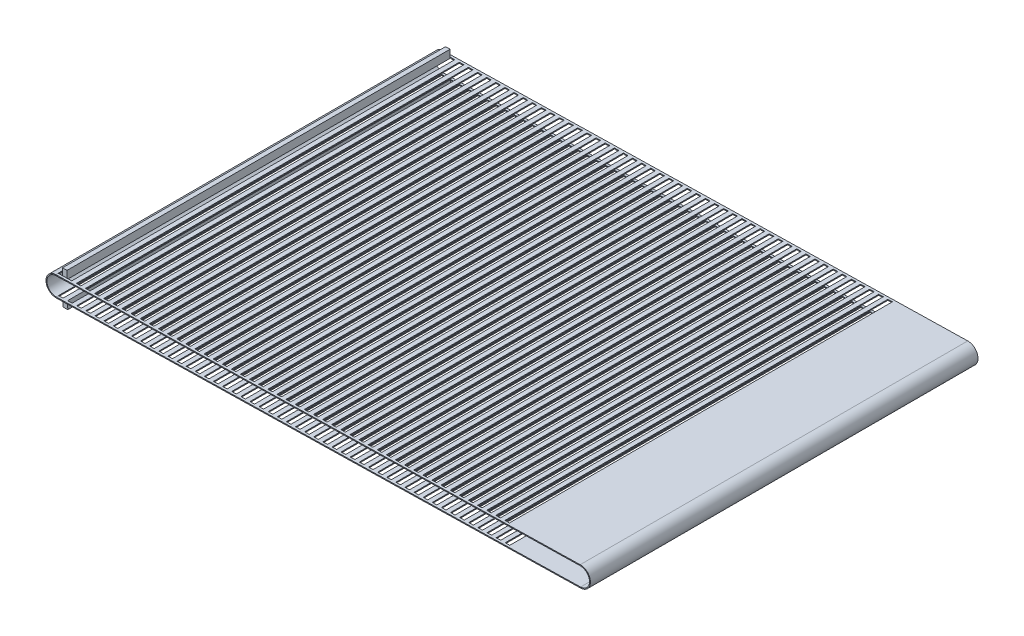
from build123d import *

# Parameters (mm, degrees)
EXTRUDE_THIN1_DEPTH = 850
SKETCH4_W           = 10
SKETCH4_H           = 840
CUT_EXTRUDE1_DEPTH  = 100
SKETCH5_W           = 10
SKETCH5_H           = 840
BOSS_EXTRUDE2_DEPTH = 15
SKETCH6_W           = 10
SKETCH6_H           = 840
BOSS_EXTRUDE3_DEPTH = 15


with BuildPart() as part:
    # Sketch1 → Extrude-Thin1 (new body)
    with BuildSketch(Plane.XY):
        with BuildLine():
            Line((540.307161019, 2.043266258), (-609.692838981, -21.99519528))
            ThreePointArc((-609.692838981, -21.99519528), (-632.147800049, -0.459765788), (-610.612370556, 21.99519528))
            Line((-610.612370556, 21.99519528), (539.387629444, 46.033656819))
            ThreePointArc((539.387629444, 46.033656819), (561.842590512, 24.498227326), (540.307161019, 2.043266258))
        make_face()
        with BuildLine():
            Line((540.265364129, 4.042829465), (-609.734635871, -19.995632073))
            ThreePointArc((-609.734635871, -19.995632073), (-630.148236842, -0.417968898), (-610.570573666, 19.995632073))
            Line((-610.570573666, 19.995632073), (539.429426334, 44.034093612))
            ThreePointArc((539.429426334, 44.034093612), (559.843027304, 24.456430436), (540.265364129, 4.042829465))
        make_face(mode=Mode.SUBTRACT)
    extrude(amount=EXTRUDE_THIN1_DEPTH)

    # Sketch4 → Cut-Extrude1 (cut)
    with BuildSketch(Plane(origin=(-0.726246886, 34.743651043, 0), x_dir=(0.9997816036520575, 0.02089844489239245, 0), z_dir=(-0.020898444892392447, 0.9997816036520574, 0))):
        with Locations((-605.019349668, -425)):
            Rectangle(SKETCH4_W, SKETCH4_H)
        with Locations((-585.019349668, -425)):
            Rectangle(SKETCH4_W, SKETCH4_H)
        with Locations((-565.019349668, -425)):
            Rectangle(SKETCH4_W, SKETCH4_H)
        with Locations((-545.019349668, -425)):
            Rectangle(SKETCH4_W, SKETCH4_H)
        with Locations((-525.019349668, -425)):
            Rectangle(SKETCH4_W, SKETCH4_H)
        with Locations((-505.019349668, -425)):
            Rectangle(SKETCH4_W, SKETCH4_H)
        with Locations((-485.019349668, -425)):
            Rectangle(SKETCH4_W, SKETCH4_H)
        with Locations((-465.019349668, -425)):
            Rectangle(SKETCH4_W, SKETCH4_H)
        with Locations((-445.019349668, -425)):
            Rectangle(SKETCH4_W, SKETCH4_H)
        with Locations((-425.019349668, -425)):
            Rectangle(SKETCH4_W, SKETCH4_H)
        with Locations((-405.019349668, -425)):
            Rectangle(SKETCH4_W, SKETCH4_H)
        with Locations((-385.019349668, -425)):
            Rectangle(SKETCH4_W, SKETCH4_H)
        with Locations((-365.019349668, -425)):
            Rectangle(SKETCH4_W, SKETCH4_H)
        with Locations((-345.019349668, -425)):
            Rectangle(SKETCH4_W, SKETCH4_H)
        with Locations((-325.019349668, -425)):
            Rectangle(SKETCH4_W, SKETCH4_H)
        with Locations((-305.019349668, -425)):
            Rectangle(SKETCH4_W, SKETCH4_H)
        with Locations((-285.019349668, -425)):
            Rectangle(SKETCH4_W, SKETCH4_H)
        with Locations((-265.019349668, -425)):
            Rectangle(SKETCH4_W, SKETCH4_H)
        with Locations((-245.019349668, -425)):
            Rectangle(SKETCH4_W, SKETCH4_H)
        with Locations((-225.019349668, -425)):
            Rectangle(SKETCH4_W, SKETCH4_H)
        with Locations((-205.019349668, -425)):
            Rectangle(SKETCH4_W, SKETCH4_H)
        with Locations((-185.019349668, -425)):
            Rectangle(SKETCH4_W, SKETCH4_H)
        with Locations((-165.019349668, -425)):
            Rectangle(SKETCH4_W, SKETCH4_H)
        with Locations((-145.019349668, -425)):
            Rectangle(SKETCH4_W, SKETCH4_H)
        with Locations((-125.019349668, -425)):
            Rectangle(SKETCH4_W, SKETCH4_H)
        with Locations((-105.019349668, -425)):
            Rectangle(SKETCH4_W, SKETCH4_H)
        with Locations((-85.019349668, -425)):
            Rectangle(SKETCH4_W, SKETCH4_H)
        with Locations((-65.019349668, -425)):
            Rectangle(SKETCH4_W, SKETCH4_H)
        with Locations((-45.019349668, -425)):
            Rectangle(SKETCH4_W, SKETCH4_H)
        with Locations((-25.019349668, -425)):
            Rectangle(SKETCH4_W, SKETCH4_H)
        with Locations((-5.019349668, -425)):
            Rectangle(SKETCH4_W, SKETCH4_H)
        with Locations((14.980650332, -425)):
            Rectangle(SKETCH4_W, SKETCH4_H)
        with Locations((34.980650332, -425)):
            Rectangle(SKETCH4_W, SKETCH4_H)
        with Locations((54.980650332, -425)):
            Rectangle(SKETCH4_W, SKETCH4_H)
        with Locations((74.980650332, -425)):
            Rectangle(SKETCH4_W, SKETCH4_H)
        with Locations((94.980650332, -425)):
            Rectangle(SKETCH4_W, SKETCH4_H)
        with Locations((114.980650332, -425)):
            Rectangle(SKETCH4_W, SKETCH4_H)
        with Locations((134.980650332, -425)):
            Rectangle(SKETCH4_W, SKETCH4_H)
        with Locations((154.980650332, -425)):
            Rectangle(SKETCH4_W, SKETCH4_H)
        with Locations((174.980650332, -425)):
            Rectangle(SKETCH4_W, SKETCH4_H)
        with Locations((194.980650332, -425)):
            Rectangle(SKETCH4_W, SKETCH4_H)
        with Locations((214.980650332, -425)):
            Rectangle(SKETCH4_W, SKETCH4_H)
        with Locations((234.980650332, -425)):
            Rectangle(SKETCH4_W, SKETCH4_H)
        with Locations((254.980650332, -425)):
            Rectangle(SKETCH4_W, SKETCH4_H)
        with Locations((274.980650332, -425)):
            Rectangle(SKETCH4_W, SKETCH4_H)
        with Locations((294.980650332, -425)):
            Rectangle(SKETCH4_W, SKETCH4_H)
        with Locations((314.980650332, -425)):
            Rectangle(SKETCH4_W, SKETCH4_H)
        with Locations((334.980650332, -425)):
            Rectangle(SKETCH4_W, SKETCH4_H)
        with Locations((354.980650332, -425)):
            Rectangle(SKETCH4_W, SKETCH4_H)
        with Locations((374.980650332, -425)):
            Rectangle(SKETCH4_W, SKETCH4_H)
    extrude(amount=-CUT_EXTRUDE1_DEPTH, mode=Mode.SUBTRACT)

    # Sketch5 → Boss-Extrude2 (add)
    with BuildSketch(Plane(origin=(-0.726246886, 34.743651043, 0), x_dir=(0.9997816036520575, 0.02089844489239245, 0), z_dir=(-0.020898444892392447, 0.9997816036520574, 0))):
        with Locations((-595.019349668, -425)):
            Rectangle(SKETCH5_W, SKETCH5_H)
    extrude(amount=BOSS_EXTRUDE2_DEPTH)

    # Sketch6 → Boss-Extrude3 (add)
    with BuildSketch(Plane(origin=(0.193284689, -9.246739518, 0), x_dir=(0.9997816036520575, 0.02089844489239246, 0), z_dir=(0.020898444892392457, -0.9997816036520574, 0))):
        with Locations((-595.019349668, 425)):
            Rectangle(SKETCH6_W, SKETCH6_H)
    extrude(amount=BOSS_EXTRUDE3_DEPTH)


solid = part.part
